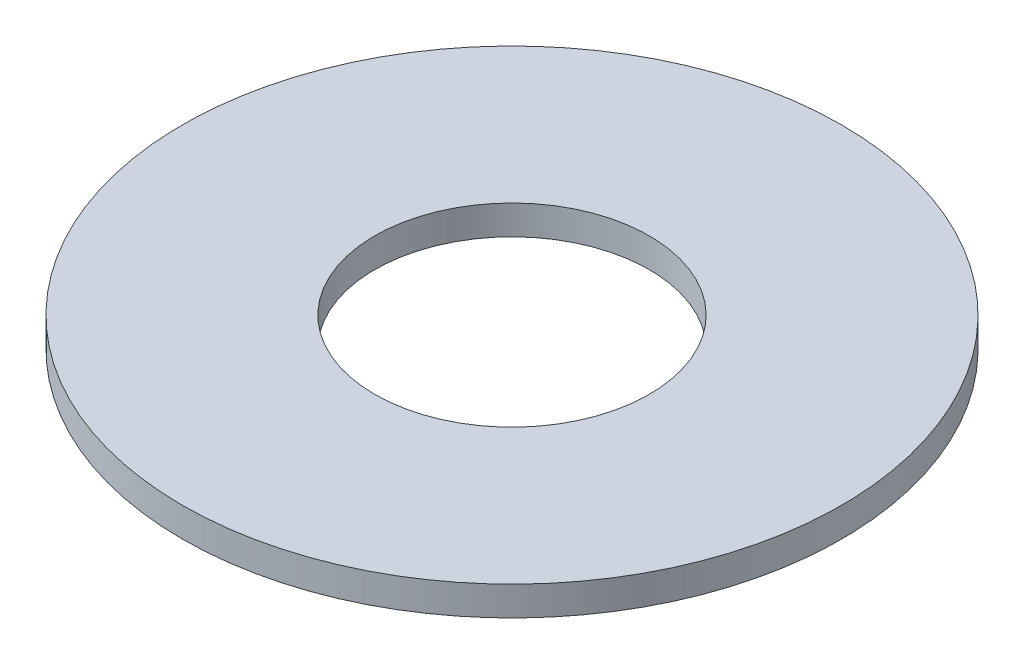
from build123d import *

# Parameters (mm, degrees)
SKETCH1_R                = 14.2875
BOSS_EXTRUDE1_DEPTH      = 1.27
F_7_16_CLEARANCE_HOLE1_D = 11.90498


with BuildPart() as part:
    # Sketch1 → Boss-Extrude1 (new body)
    with BuildSketch(Plane(origin=(0, 0, 0), x_dir=(1, 0, 0), z_dir=(0, 1, 0))):
        with Locations(Location((0, 0, 0), (0, 0, 270))):
            Circle(SKETCH1_R)
    extrude(amount=BOSS_EXTRUDE1_DEPTH)

    # 7/16 Clearance Hole1 (through all)
    with Locations(Plane(origin=(0, 1.27, 0), x_dir=(1, 0, 0), z_dir=(0, 1, 0))):
        with Locations((0, 0)):
            Hole(F_7_16_CLEARANCE_HOLE1_D / 2)


solid = part.part
